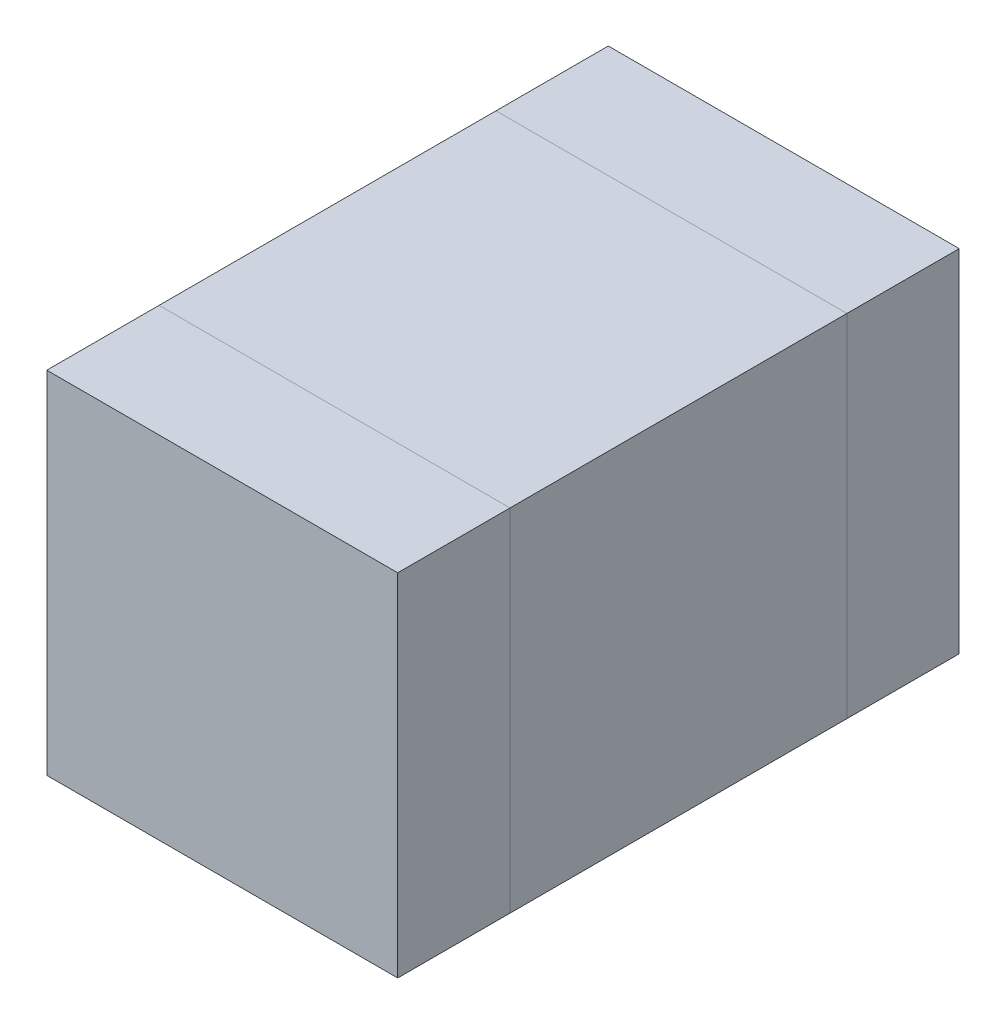
from build123d import *

# Parameters (mm, degrees)
MAINBODYS_W     = 1.25
MAINBODYS_H     = 1.2
MAINBODY_DEPTH  = 1.25
LEFTBODYS_W     = 1.25
LEFTBODYS_H     = 0.4
LEFTBODY_DEPTH  = 1.25
RIGHTBODYS_W    = 1.25
RIGHTBODYS_H    = 0.4
RIGHTBODY_DEPTH = 1.25


with BuildPart() as part:
    # MainBodyS → MainBody (new body)
    with BuildSketch(Plane(origin=(0, 0, 0), x_dir=(1, 0, 0), z_dir=(0, 1, 0))):
        Rectangle(MAINBODYS_W, MAINBODYS_H)
    extrude(amount=MAINBODY_DEPTH)


with BuildPart() as body_2:
    # LeftBodyS → LeftBody (new body)
    with BuildSketch(Plane(origin=(0, 0, 0), x_dir=(-1, 0, 0), z_dir=(0, -1, 0))):
        with Locations((0, -0.8)):
            Rectangle(LEFTBODYS_W, LEFTBODYS_H)
    extrude(amount=-LEFTBODY_DEPTH)


with BuildPart() as body_3:
    # RightBodyS → RightBody (new body)
    with BuildSketch(Plane.XZ):
        with Locations((0, -0.8)):
            Rectangle(RIGHTBODYS_W, RIGHTBODYS_H)
    extrude(amount=-RIGHTBODY_DEPTH)


solid = Compound([part.part, body_2.part, body_3.part])
